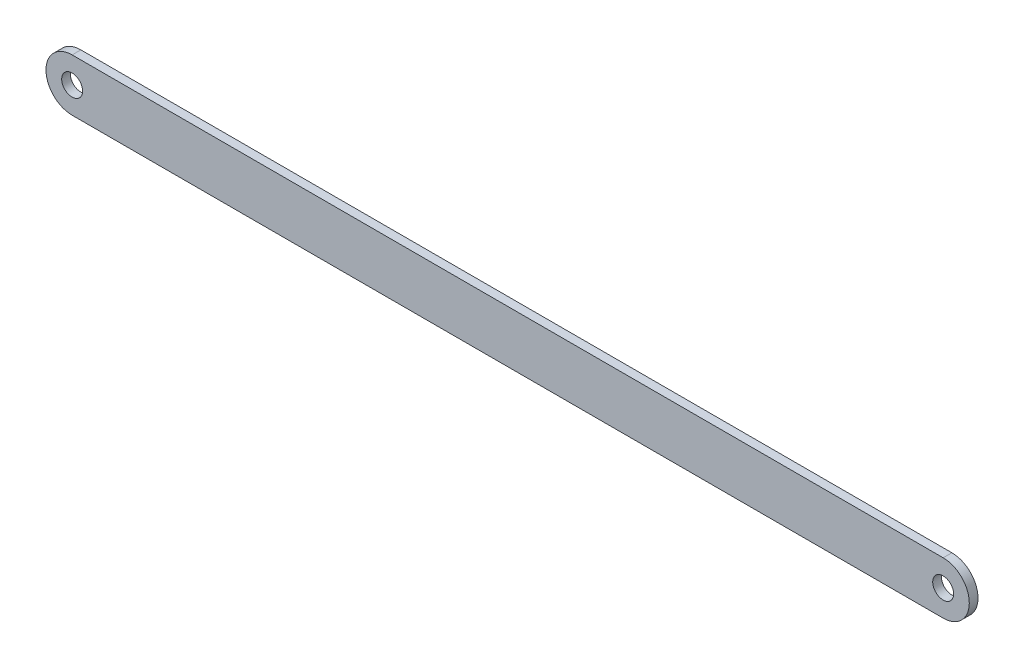
from build123d import *

# Parameters (mm, degrees)
SKETCH1_R           = 6
BOSS_EXTRUDE1_DEPTH = 5


with BuildPart() as part:
    # Sketch1 → Boss-Extrude1 (new body)
    with BuildSketch(Plane.XY):
        with BuildLine():
            Line((120, -111), (620, -111))
            ThreePointArc((620, -111), (635, -126), (620, -141))
            Line((620, -141), (120, -141))
            ThreePointArc((120, -141), (105, -126), (120, -111))
        make_face()
        with Locations((120, -126)):
            Circle(SKETCH1_R, mode=Mode.SUBTRACT)
        with Locations((620, -126)):
            Circle(SKETCH1_R, mode=Mode.SUBTRACT)
    extrude(amount=BOSS_EXTRUDE1_DEPTH)


solid = part.part
